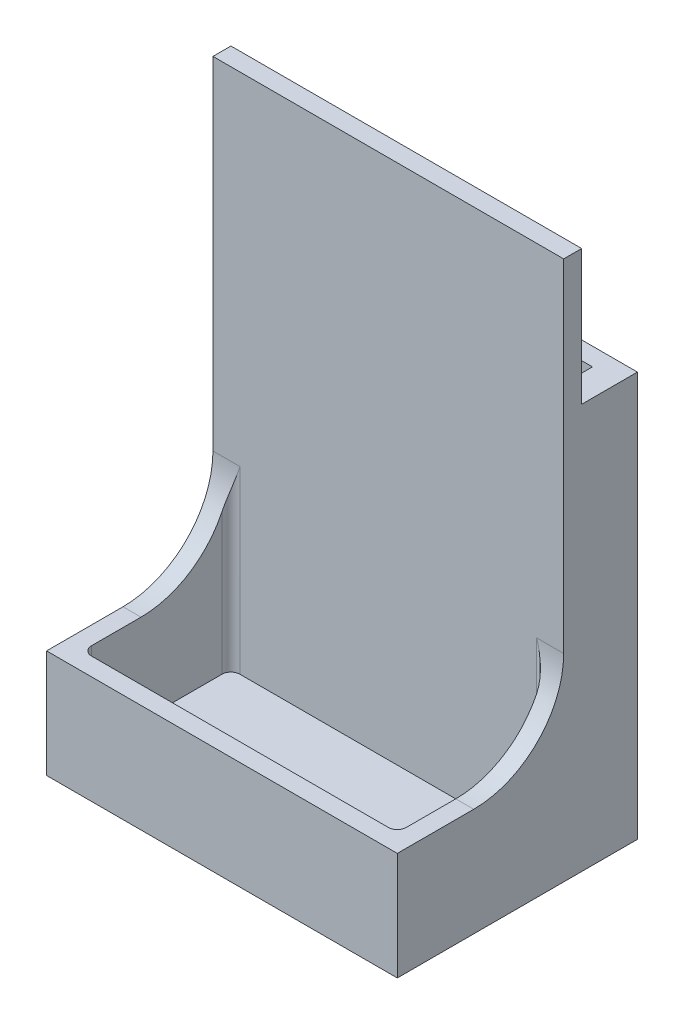
from build123d import *

# Parameters (mm, degrees)
SKETCH1_W           = 39
SKETCH1_H           = 20.5
BOSS_EXTRUDE1_DEPTH = 2
SKETCH2_W           = 39
SKETCH2_H           = 20.5
SKETCH2_W_2         = 35
SKETCH2_H_2         = 16.5
BOSS_EXTRUDE2_DEPTH = 10
SKETCH3_W           = 39
SKETCH3_H           = 2
BOSS_EXTRUDE3_DEPTH = 48
FILLET1_R           = 10
FILLET2_R           = 1
BOSS_EXTRUDE4_DEPTH = 45


with BuildPart() as part:
    # Sketch1 → Boss-Extrude1 (new body)
    with BuildSketch(Plane(origin=(0, 0, 0), x_dir=(1, 0, 0), z_dir=(0, 1, 0))):
        Rectangle(SKETCH1_W, SKETCH1_H)
    extrude(amount=BOSS_EXTRUDE1_DEPTH)

    # Sketch2 → Boss-Extrude2 (add)
    with BuildSketch(Plane(origin=(0, 2, 0), x_dir=(1, 0, 0), z_dir=(0, 1, 0))):
        Rectangle(SKETCH2_W, SKETCH2_H)
        Rectangle(SKETCH2_W_2, SKETCH2_H_2, mode=Mode.SUBTRACT)
    extrude(amount=BOSS_EXTRUDE2_DEPTH)

    # Sketch3 → Boss-Extrude3 (add)
    with BuildSketch(Plane(origin=(0, 12, 0), x_dir=(1, 0, 0), z_dir=(0, 1, 0))):
        with Locations((0, 9.25)):
            Rectangle(SKETCH3_W, SKETCH3_H)
    extrude(amount=BOSS_EXTRUDE3_DEPTH)

    # Fillet1
    fillet1_edges = [part.edges().sort_by_distance(p)[0] for p in [
        (18.5, 12, -8.25),
        (-18.5, 12, -8.25),
    ]]
    fillet(fillet1_edges, radius=FILLET1_R)

    # Fillet2
    fillet2_edges = [part.edges().sort_by_distance(p)[0] for p in [
        (-17.5, 7, 8.25),
        (17.5, 7, 8.25),
        (17.5, 12, -8.25),
        (-17.5, 12, -8.25),
    ]]
    fillet(fillet2_edges, radius=FILLET2_R)

    # Sketch4 → Boss-Extrude4 (add)
    with BuildSketch(Plane.XZ):
        Polygon((-19.5, -10.25), (-19.5, -16.45), (-11.5, -16.45), (-11.5, -14.45), (-16.5, -14.45), (-16.5, -11.25), (-8.5, -11.25), (-6.767949192, -10.25), align=None)
    boss_extrude4 = extrude(amount=-BOSS_EXTRUDE4_DEPTH)

    # Mirror2: Boss-Extrude4 across plane
    add(boss_extrude4.mirror(Plane.ZY))


solid = part.part
